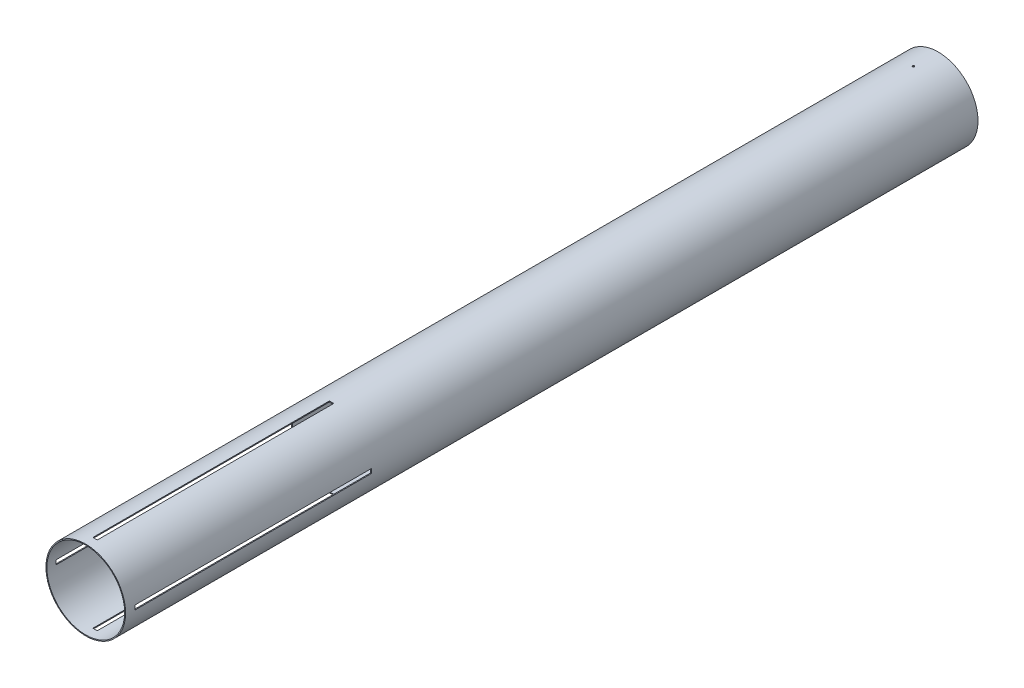
from build123d import *

# Parameters (mm, degrees)
SKETCH1_R           = 64
SKETCH1_R_2         = 62.5
BOSS_EXTRUDE1_DEPTH = 685
SKETCH2_W           = 7
SKETCH2_H           = 380
CUT_EXTRUDE1_DEPTH  = 75
CIRPATTERN1_COUNT   = 4
SKETCH3_R           = 1.5
CUT_EXTRUDE2_DEPTH  = 691.953688752


with BuildPart() as part:
    # Sketch1 → Boss-Extrude1 (new, symmetric)
    with BuildSketch(Plane.XY):
        Circle(SKETCH1_R)
        Circle(SKETCH1_R_2, mode=Mode.SUBTRACT)
    extrude(amount=BOSS_EXTRUDE1_DEPTH, both=True)

    # Sketch2 → Cut-Extrude1 (cut, symmetric)
    with BuildSketch(Plane(origin=(0, 0, 0), x_dir=(1, 0, 0), z_dir=(0, 1, 0))):
        with Locations((0, -480)):
            Rectangle(SKETCH2_W, SKETCH2_H)
    cut_extrude1 = extrude(amount=CUT_EXTRUDE1_DEPTH, both=True, mode=Mode.SUBTRACT)

    # CirPattern1: Cut-Extrude1 ×4 about axis
    cirpattern1_axis = Axis((0, 0, 685), (0, 0, 1))
    for i in range(1, CIRPATTERN1_COUNT):
        add(cut_extrude1.rotate(cirpattern1_axis, i * 360 / CIRPATTERN1_COUNT), mode=Mode.SUBTRACT)

    # Sketch3 → Cut-Extrude2 (cut, through all)
    with BuildSketch(Plane(origin=(0, 0, 0), x_dir=(1, 0, 0), z_dir=(0, 1, 0))):
        with Locations(Location((0, 645, 0), (0, 0, 90))):
            Circle(SKETCH3_R)
    extrude(amount=CUT_EXTRUDE2_DEPTH, mode=Mode.SUBTRACT)


solid = part.part
